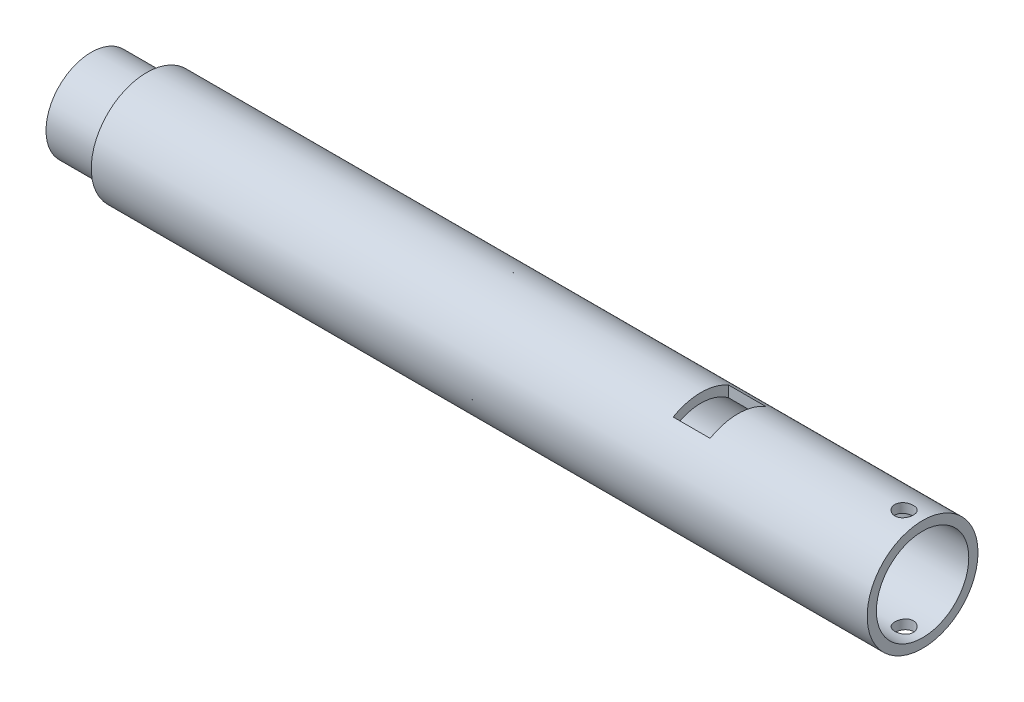
from build123d import *

# Parameters (mm, degrees)
ESBO_O1_R                  = 15
ESBO_O1_R_2                = 12.5
RESSALTO_EXTRUS_O1_DEPTH   = 210
RESSALTO_EXTRUS_O3_START   = 15
ESBO_O2_R                  = 12.25
ESBO_O2_R_2                = 10
RESSALTO_EXTRUS_O3_DEPTH   = 15
CORTE_EXTRUS_O2_DEPTH      = 300
CORTE_EXTRUS_O2_DEPTH_BACK = 300
ESBO_O4_R                  = 2.5
ESBO_O6_W                  = 10
ESBO_O6_H                  = 15
CORTE_EXTRUS_O4_DEPTH      = 20
ESBO_O7_R                  = 12.5
RESSALTO_EXTRUS_O4_DEPTH   = 10
ESBO_O11_R                 = 10
CORTE_EXTRUS_O8_DEPTH      = 20


with BuildPart() as part:
    # Esboço1 → Ressalto-extrusão1 (new body)
    with BuildSketch(Plane(origin=(0, 0, 0), x_dir=(0, 0, -1), z_dir=(1, 0, 0))):
        Circle(ESBO_O1_R)
        Circle(ESBO_O1_R_2, mode=Mode.SUBTRACT)
    extrude(amount=RESSALTO_EXTRUS_O1_DEPTH)

    # Esboço4 → Corte-extrusão2 (cut, two sides: drawn at the far end of the back side and taken through both)
    with BuildSketch(Plane(origin=(0, 0, 0), x_dir=(1, 0, 0), z_dir=(0, 1, 0)).offset(-CORTE_EXTRUS_O2_DEPTH_BACK)):
        with Locations((205, 0)):
            Circle(ESBO_O4_R)
    extrude(amount=CORTE_EXTRUS_O2_DEPTH + CORTE_EXTRUS_O2_DEPTH_BACK, mode=Mode.SUBTRACT)

    # Esboço6 → Corte-extrusão4 (cut)
    with BuildSketch(Plane(origin=(0, 0, 0), x_dir=(1, 0, 0), z_dir=(0, 1, 0))):
        with Locations((155, 0)):
            Rectangle(ESBO_O6_W, ESBO_O6_H)
    extrude(amount=CORTE_EXTRUS_O4_DEPTH, mode=Mode.SUBTRACT)



with BuildPart() as body_2:
    # Esboço2 → Ressalto-extrusão3 (new body)
    with BuildSketch(Plane.ZY.offset(RESSALTO_EXTRUS_O3_START)):
        Circle(ESBO_O2_R)
        Circle(ESBO_O2_R_2, mode=Mode.SUBTRACT)
    extrude(amount=-RESSALTO_EXTRUS_O3_DEPTH)


with BuildPart() as part_1:
    add(part.part)

    add(body_2.part)  # Ressalto-extrusão4 merges body 2
    # Esboço7 → Ressalto-extrusão4 (add)
    with BuildSketch(Plane.ZY):
        Circle(ESBO_O7_R)
    extrude(amount=-RESSALTO_EXTRUS_O4_DEPTH)

    # Esboço11 → Corte-extrusão8 (cut)
    with BuildSketch(Plane.ZY):
        Circle(ESBO_O11_R)
    extrude(amount=-CORTE_EXTRUS_O8_DEPTH, mode=Mode.SUBTRACT)


solid = part_1.part
